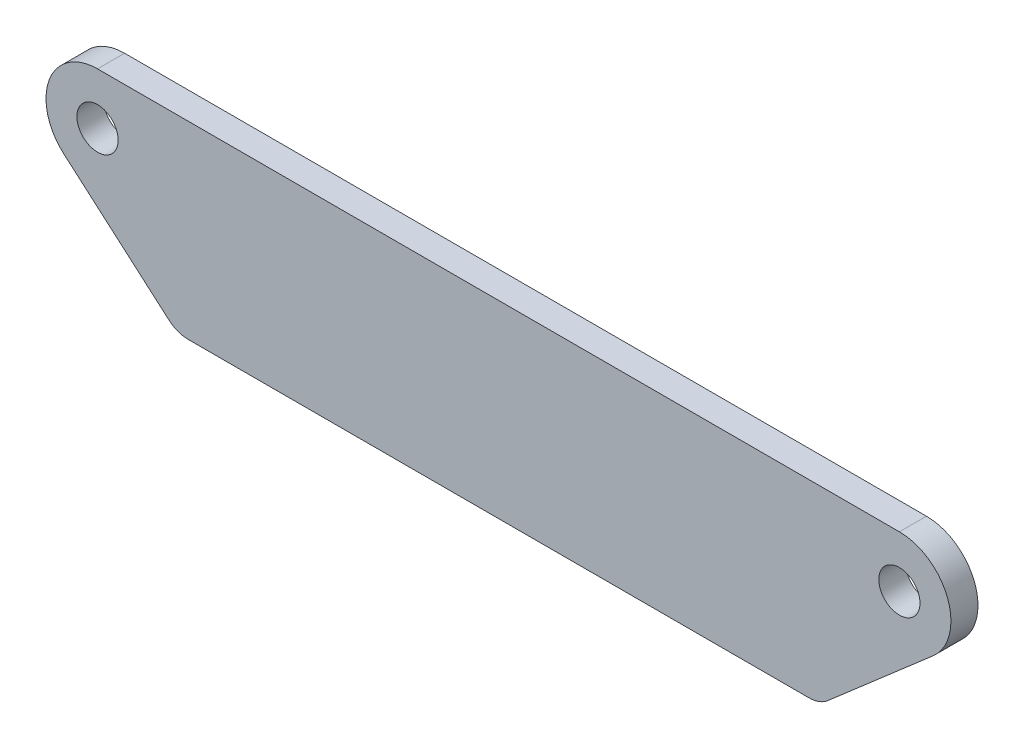
from build123d import *

# Parameters (mm, degrees)
SKETCH1_R  = 2.286
MAIN_DEPTH = 3


with BuildPart() as part:
    # Sketch1 → Main (new body)
    with BuildSketch(Plane.XY):
        with BuildLine():
            Line((-3.747467174, 2.035175), (7.936110478, -8.112125))
            ThreePointArc((7.936110478, -8.112125), (8.906786685, -8.689180297), (10.018036685, -8.89))
            Line((10.018036685, -8.89), (78.881963315, -8.89))
            ThreePointArc((78.881963315, -8.89), (79.993213315, -8.689180297), (80.963889522, -8.112125))
            Line((80.963889522, -8.112125), (92.647467174, 2.035175))
            ThreePointArc((92.647467174, 2.035175), (94.253524534, 8.35025), (88.9, 12.065))
            Line((88.9, 12.065), (0, 12.065))
            ThreePointArc((0, 12.065), (-5.353524534, 8.35025), (-3.747467174, 2.035175))
        make_face()
        with Locations((0, 6.35)):
            Circle(SKETCH1_R, mode=Mode.SUBTRACT)
        with Locations((88.9, 6.35)):
            Circle(SKETCH1_R, mode=Mode.SUBTRACT)
    extrude(amount=MAIN_DEPTH)


solid = part.part
